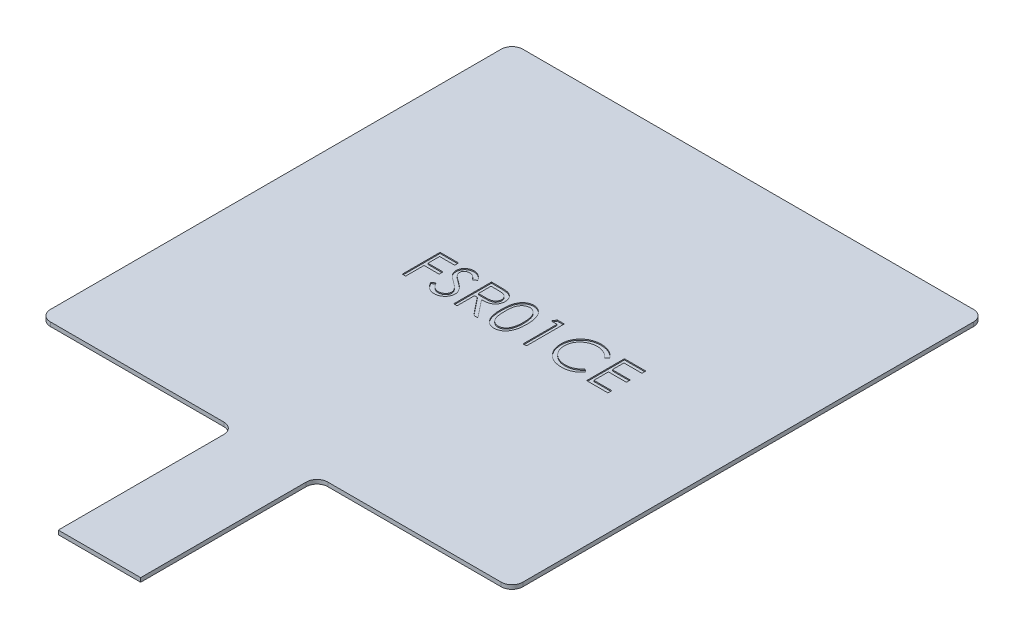
from build123d import *

# Parameters (mm, degrees)
SKETCH1_W           = 7.62
SKETCH1_H           = 16.31
SKETCH1_W_2         = 43.69
SKETCH1_H_2         = 43.69
SKETCH1_W_3         = 39.7
SKETCH1_H_3         = 39.7
BOSS_EXTRUDE1_DEPTH = 0.375
CUT_EXTRUDE1_DEPTH  = 0.1
FILLET1_R           = 1


with BuildPart() as part:
    # Sketch1 → Boss-Extrude1 (new body)
    # profile 1 of 3: a face of its own
    with BuildSketch(Plane(origin=(0, 0, 0), x_dir=(1, 0, 0), z_dir=(0, 1, 0))):
        with Locations((0, -30)):
            Rectangle(SKETCH1_W, SKETCH1_H)
    # profile 2 of 3: a face of its own
    with BuildSketch(Plane(origin=(0, 0, 0), x_dir=(1, 0, 0), z_dir=(0, 1, 0))):
        Rectangle(SKETCH1_W_2, SKETCH1_H_2)
        Rectangle(SKETCH1_W_3, SKETCH1_H_3, mode=Mode.SUBTRACT)
    # profile 3 of 3: a face of its own
    with BuildSketch(Plane(origin=(0, 0, 0), x_dir=(1, 0, 0), z_dir=(0, 1, 0))):
        Rectangle(SKETCH1_W_3, SKETCH1_H_3)
    extrude(amount=BOSS_EXTRUDE1_DEPTH)

    # Sketch2 → Cut-Extrude1 (cut)
    # profile 1 of 7: a face of its own
    with BuildSketch(Plane(origin=(0, 0.375, 0), x_dir=(1, 0, 0), z_dir=(0, 1, 0))):
        Polygon((-8.401282051, 1.75), (-6.696153846, 1.75), (-6.696153846, 1.391025641), (-8.087179487, 1.391025641), (-8.087179487, 0.314102564), (-6.696153846, 0.314102564), (-6.696153846, -0.044871795), (-8.087179487, -0.044871795), (-8.087179487, -1.75), (-8.401282051, -1.75), align=None)
    # profile 2 of 7: a face of its own
    with BuildSketch(Plane(origin=(0, 0.375, 0), x_dir=(1, 0, 0), z_dir=(0, 1, 0))):
        with BuildLine():
            Line((-6.426923077, -1.074819712), (-6.131049679, -0.897435897))
            add(Edge.make_bspline(
                [(-6.131049679, -0.897435897), (-6.103531442, -0.943500282), (-6.050807562, -1.031757866), (-5.962856202, -1.151015907), (-5.871723291, -1.252378063), (-5.776733958, -1.335254671), (-5.67846801, -1.400503558), (-5.576283956, -1.446705789), (-5.470526145, -1.475521765), (-5.398552324, -1.479021851), (-5.362620192, -1.480769231)],
                knots=[0, 0, 0, 0, 1.272034388, 2.437168799, 3.508375237, 4.49857839, 5.41946034, 6.295179144, 7.148887113, 8, 8, 8, 8], degree=3))
            add(Edge.make_bspline(
                [(-5.362620192, -1.480769231), (-5.331933332, -1.479914558), (-5.271096559, -1.478220168), (-5.181534316, -1.461939366), (-5.094552514, -1.436927237), (-5.011943876, -1.401106306), (-4.934848261, -1.35776782), (-4.867241566, -1.305421642), (-4.808795453, -1.246815437), (-4.760986338, -1.181432782), (-4.724306303, -1.111115633), (-4.696114234, -1.038939682), (-4.680469161, -0.963771114), (-4.678112407, -0.913160651), (-4.676923077, -0.887620192)],
                knots=[0, 0, 0, 0, 1.095163259, 2.171163733, 3.241058638, 4.321873601, 5.38011039, 6.391990106, 7.366004449, 8.327778327, 9.272591725, 10.192022065, 11.087607919, 12, 12, 12, 12], degree=3))
            add(Edge.make_bspline(
                [(-4.676923077, -0.887620192), (-4.678397388, -0.858479343), (-4.681394446, -0.799240253), (-4.706725926, -0.7118406), (-4.746575173, -0.62534803), (-4.783337816, -0.571846765), (-4.802423878, -0.544070513)],
                knots=[0, 0, 0, 0, 0.938893495, 1.908633276, 2.914225137, 4, 4, 4, 4], degree=3))
            add(Edge.make_bspline(
                [(-4.802423878, -0.544070513), (-4.818094492, -0.524023689), (-4.850992987, -0.481937891), (-4.907550499, -0.419292655), (-4.973916614, -0.354674236), (-5.047820168, -0.285615179), (-5.131953257, -0.215327383), (-5.223680772, -0.140459105), (-5.325344631, -0.063857528), (-5.396644127, -0.012484962), (-5.433433494, 0.014022436)],
                knots=[0, 0, 0, 0, 0.722233717, 1.516239348, 2.393582979, 3.351407094, 4.387010283, 5.505090956, 6.712668013, 8, 8, 8, 8], degree=3))
            add(Edge.make_bspline(
                [(-5.433433494, 0.014022436), (-5.47025749, 0.040251024), (-5.540662166, 0.090398086), (-5.639120749, 0.16482237), (-5.727165212, 0.232866239), (-5.804404228, 0.295170251), (-5.870803825, 0.351742856), (-5.926887236, 0.402040795), (-5.971225793, 0.447424356), (-5.995881374, 0.476865698), (-6.006951122, 0.490084135)],
                knots=[0, 0, 0, 0, 1.452282411, 2.77665338, 3.964542531, 5.026858415, 5.96415736, 6.766646006, 7.446254459, 8, 8, 8, 8], degree=3))
            add(Edge.make_bspline(
                [(-6.006951122, 0.490084135), (-6.022423667, 0.510685171), (-6.052852504, 0.551199875), (-6.093018509, 0.614524733), (-6.127157672, 0.679347998), (-6.153920004, 0.745843863), (-6.176456223, 0.813078792), (-6.191614154, 0.881930038), (-6.201105551, 0.952088656), (-6.202077537, 0.999302157), (-6.202564103, 1.022936699)],
                knots=[0, 0, 0, 0, 1.068054152, 2.10047183, 3.106115577, 4.101338837, 5.06977816, 6.043150881, 7.020423561, 8, 8, 8, 8], degree=3))
            add(Edge.make_bspline(
                [(-6.202564103, 1.022936699), (-6.201258894, 1.059966473), (-6.198676374, 1.133234537), (-6.176835856, 1.240265367), (-6.142362963, 1.342451785), (-6.094068075, 1.438782118), (-6.031810722, 1.526748099), (-5.959764747, 1.607361586), (-5.873953261, 1.675130168), (-5.779800638, 1.734342227), (-5.676744266, 1.780688152), (-5.568753362, 1.815649132), (-5.45565629, 1.83545839), (-5.379053156, 1.838301155), (-5.340184295, 1.83974359)],
                knots=[0, 0, 0, 0, 1.005424448, 1.989358655, 2.955360095, 3.929531133, 4.905563448, 5.876582895, 6.856512386, 7.866279853, 8.892233794, 9.918561126, 10.94386622, 12, 12, 12, 12], degree=3))
            add(Edge.make_bspline(
                [(-5.340184295, 1.83974359), (-5.298940195, 1.838321038), (-5.216918843, 1.835492037), (-5.096269627, 1.810894506), (-4.980108911, 1.770193834), (-4.886665646, 1.724005176), (-4.813532885, 1.67787376), (-4.757760152, 1.635853936), (-4.701242701, 1.587478827), (-4.643524646, 1.532619581), (-4.585583987, 1.47077283), (-4.526560535, 1.402362141), (-4.466316266, 1.327805585), (-4.427560406, 1.274581085), (-4.407692308, 1.247295673)],
                knots=[0, 0, 0, 0, 1.286793592, 2.559021753, 3.825965368, 5.121522368, 5.803751409, 6.523245864, 7.299691795, 8.125521123, 9.008227632, 9.944561021, 10.946284179, 12, 12, 12, 12], degree=3))
            Line((-4.407692308, 1.247295673), (-4.691646635, 1.032051282))
            add(Edge.make_bspline(
                [(-4.691646635, 1.032051282), (-4.708792567, 1.054139972), (-4.741811624, 1.096677626), (-4.791941111, 1.156248941), (-4.839189759, 1.210665421), (-4.885740159, 1.257930549), (-4.92913379, 1.300632682), (-4.971250832, 1.337192439), (-5.011485184, 1.367968034), (-5.062202094, 1.400811594), (-5.125919813, 1.433368098), (-5.205904349, 1.460917176), (-5.289490624, 1.477472238), (-5.346420255, 1.479661126), (-5.375240385, 1.480769231)],
                knots=[0, 0, 0, 0, 1.181633172, 2.275549214, 3.290209073, 4.226197932, 5.078386478, 5.862611352, 6.581680152, 7.217281963, 8.414376989, 9.595101626, 10.782541182, 12, 12, 12, 12], degree=3))
            add(Edge.make_bspline(
                [(-5.375240385, 1.480769231), (-5.411396907, 1.479557531), (-5.481121354, 1.477220882), (-5.580111591, 1.451700896), (-5.669205516, 1.411519036), (-5.745758081, 1.355204058), (-5.809495058, 1.288483065), (-5.855600516, 1.21170421), (-5.883350681, 1.126921808), (-5.886736961, 1.067780151), (-5.888461538, 1.037660256)],
                knots=[0, 0, 0, 0, 1.14458467, 2.207223713, 3.21896685, 4.227309161, 5.202851033, 6.127160689, 7.046193047, 8, 8, 8, 8], degree=3))
            add(Edge.make_bspline(
                [(-5.888461538, 1.037660256), (-5.888068412, 1.018908778), (-5.887281516, 0.981375158), (-5.876306718, 0.925923736), (-5.862207389, 0.870612397), (-5.839864757, 0.815689814), (-5.809019454, 0.760195455), (-5.768514278, 0.703173718), (-5.717500966, 0.644122009), (-5.678423953, 0.605714635), (-5.657792468, 0.585436699)],
                knots=[0, 0, 0, 0, 0.858281714, 1.717966888, 2.583508476, 3.4729293, 4.427298488, 5.488583878, 6.674047936, 8, 8, 8, 8], degree=3))
            add(Edge.make_bspline(
                [(-5.657792468, 0.585436699), (-5.650131096, 0.578599673), (-5.631929428, 0.562356465), (-5.598653503, 0.535764184), (-5.554710704, 0.502961412), (-5.501248503, 0.462374095), (-5.437281142, 0.415292633), (-5.362801585, 0.362319021), (-5.278640053, 0.301733562), (-5.218918137, 0.259376021), (-5.187339744, 0.236979167)],
                knots=[0, 0, 0, 0, 0.420754252, 0.999615792, 1.744751191, 2.668019286, 3.750313428, 4.999500688, 6.413464383, 8, 8, 8, 8], degree=3))
            add(Edge.make_bspline(
                [(-5.187339744, 0.236979167), (-5.14935383, 0.209337807), (-5.075799374, 0.155814145), (-4.971141794, 0.075398465), (-4.876247986, -0.003249303), (-4.790784782, -0.07962691), (-4.713907874, -0.153155003), (-4.646470153, -0.224718184), (-4.587784473, -0.293803756), (-4.524605254, -0.382376332), (-4.460047435, -0.491157416), (-4.404605927, -0.624435655), (-4.36964758, -0.758231975), (-4.365076065, -0.848158812), (-4.362820513, -0.892528045)],
                knots=[0, 0, 0, 0, 1.163667725, 2.253281268, 3.268753668, 4.215851969, 5.092017293, 5.902905408, 6.650798638, 7.335211899, 8.59617414, 9.77448103, 10.901945474, 12, 12, 12, 12], degree=3))
            add(Edge.make_bspline(
                [(-4.362820513, -0.892528045), (-4.363477651, -0.92390641), (-4.364779166, -0.986053794), (-4.37974008, -1.07730887), (-4.401659745, -1.16593974), (-4.434696979, -1.250850853), (-4.475020137, -1.333595615), (-4.526186385, -1.412003516), (-4.58549407, -1.487809914), (-4.653527835, -1.558993406), (-4.727973737, -1.624339602), (-4.806657432, -1.682468663), (-4.889707705, -1.730936986), (-4.976674021, -1.770487828), (-5.067576358, -1.801421346), (-5.162384142, -1.823834215), (-5.261253653, -1.837589926), (-5.328454135, -1.839017687), (-5.362620192, -1.83974359)],
                knots=[0, 0, 0, 0, 0.983748083, 1.948392443, 2.894712957, 3.844097841, 4.80183111, 5.778335162, 6.776009319, 7.81870978, 8.863265674, 9.881300176, 10.883814829, 11.87499822, 12.874611388, 13.892143829, 14.928324115, 16, 16, 16, 16], degree=3))
            add(Edge.make_bspline(
                [(-5.362620192, -1.83974359), (-5.389055535, -1.839232408), (-5.441593295, -1.838216483), (-5.519302777, -1.829235202), (-5.595442366, -1.816528099), (-5.669056648, -1.796354029), (-5.74109406, -1.771877052), (-5.811241295, -1.741738719), (-5.879532348, -1.705621518), (-5.946349931, -1.664326493), (-6.011524106, -1.616268748), (-6.074443574, -1.560295252), (-6.137172759, -1.497949747), (-6.197860156, -1.427539184), (-6.2577333, -1.350201101), (-6.31561171, -1.265211917), (-6.372693427, -1.173034564), (-6.408508895, -1.108169478), (-6.426923077, -1.074819712)],
                knots=[0, 0, 0, 0, 0.915332311, 1.819136955, 2.706846663, 3.586547465, 4.459518054, 5.340707479, 6.227863349, 7.133153174, 8.059268498, 9.028702269, 10.047606654, 11.120612155, 12.245963614, 13.433783089, 14.680604001, 16, 16, 16, 16], degree=3))
        make_face()
    # profile 3 of 7: a face of its own
    with BuildSketch(Plane(origin=(0, 0.375, 0), x_dir=(1, 0, 0), z_dir=(0, 1, 0))):
        with BuildLine():
            Line((-3.644871795, 1.75), (-2.944451122, 1.75))
            add(Edge.make_bspline(
                [(-2.944451122, 1.75), (-2.897709993, 1.749844414), (-2.807961849, 1.749545672), (-2.679388579, 1.747879909), (-2.562561482, 1.743105553), (-2.457541642, 1.73899697), (-2.364330987, 1.731505028), (-2.282643696, 1.724344381), (-2.212855999, 1.71497072), (-2.170610148, 1.706265297), (-2.151482372, 1.702323718)],
                knots=[0, 0, 0, 0, 1.410062039, 2.707475311, 3.878576406, 4.937260626, 5.877586885, 6.699081471, 7.410979367, 8, 8, 8, 8], degree=3))
            add(Edge.make_bspline(
                [(-2.151482372, 1.702323718), (-2.125875748, 1.695996953), (-2.075208758, 1.683478389), (-2.002258692, 1.657018788), (-1.932744368, 1.626399163), (-1.866954544, 1.590435443), (-1.805218753, 1.548860663), (-1.746900442, 1.502392541), (-1.691734979, 1.451285335), (-1.641953348, 1.394250494), (-1.595014297, 1.334413984), (-1.55542567, 1.269710227), (-1.52129919, 1.2020487), (-1.494128673, 1.130741282), (-1.4722507, 1.05647951), (-1.456824461, 0.978590713), (-1.447573273, 0.897429738), (-1.446631417, 0.84207183), (-1.446153846, 0.814002404)],
                knots=[0, 0, 0, 0, 1.027469482, 2.033020251, 3.019912614, 3.986113645, 4.951240523, 5.91722682, 6.890402269, 7.87763091, 8.8651537, 9.85103654, 10.82876324, 11.815024772, 12.821070561, 13.842952187, 14.906261191, 16, 16, 16, 16], degree=3))
            add(Edge.make_bspline(
                [(-1.446153846, 0.814002404), (-1.447622844, 0.767367299), (-1.45048924, 0.676370131), (-1.477214344, 0.54430925), (-1.520990863, 0.421119935), (-1.581314152, 0.306957297), (-1.658133628, 0.204046652), (-1.750458419, 0.113656197), (-1.858340031, 0.038016284), (-1.958769347, -0.014436521), (-2.047483546, -0.048029429), (-2.120516859, -0.071665788), (-2.200183837, -0.089927753), (-2.285721171, -0.106287885), (-2.377484827, -0.11863958), (-2.475254866, -0.127686174), (-2.579101018, -0.133340223), (-2.650440087, -0.134182228), (-2.687139423, -0.134615385)],
                knots=[0, 0, 0, 0, 1.260483769, 2.459530307, 3.627416485, 4.787058657, 5.939039949, 7.08810263, 8.267026773, 9.491475466, 10.141966685, 10.831826277, 11.566392101, 12.351337768, 13.187381173, 14.07005841, 15.007169909, 16, 16, 16, 16], degree=3))
            Line((-2.687139423, -0.134615385), (-1.401282051, -1.75))
            Line((-1.401282051, -1.75), (-1.789703526, -1.75))
            Line((-1.789703526, -1.75), (-3.075560897, -0.134615385))
            Line((-3.075560897, -0.134615385), (-3.330769231, -0.134615385))
            Line((-3.330769231, -0.134615385), (-3.330769231, -1.75))
            Line((-3.330769231, -1.75), (-3.644871795, -1.75))
            Line((-3.644871795, -1.75), (-3.644871795, 1.75))
        make_face()
        with BuildLine():
            Line((-3.330769231, 1.391025641), (-3.330769231, 0.224358974))
            Line((-3.330769231, 0.224358974), (-2.68994391, 0.219451122))
            add(Edge.make_bspline(
                [(-2.68994391, 0.219451122), (-2.660023871, 0.219437885), (-2.602030314, 0.219412229), (-2.518129649, 0.223406005), (-2.440009538, 0.227949323), (-2.367968786, 0.234898669), (-2.30197521, 0.24385474), (-2.242061797, 0.255057725), (-2.188130745, 0.268109787), (-2.125232207, 0.288311413), (-2.054995675, 0.320317431), (-1.978664215, 0.36688293), (-1.913661878, 0.425452049), (-1.858744015, 0.492425505), (-1.814614584, 0.566061754), (-1.78350253, 0.645478123), (-1.763760087, 0.728669721), (-1.761431542, 0.785847829), (-1.76025641, 0.814703526)],
                knots=[0, 0, 0, 0, 1.146690395, 2.22261258, 3.21895312, 4.145990853, 4.996080663, 5.770904154, 6.481378293, 7.121626537, 8.300444488, 9.431385265, 10.535395872, 11.636531494, 12.74115979, 13.810798291, 14.895190096, 16, 16, 16, 16], degree=3))
            add(Edge.make_bspline(
                [(-1.76025641, 0.814703526), (-1.761458531, 0.842850099), (-1.763840697, 0.898626338), (-1.783289465, 0.980282248), (-1.816178847, 1.057349198), (-1.860501085, 1.129513683), (-1.914500239, 1.195019419), (-1.977818052, 1.251066572), (-2.048723247, 1.297316037), (-2.114994446, 1.326870418), (-2.174228658, 1.344990271), (-2.225658318, 1.357741435), (-2.283769796, 1.367985904), (-2.348845255, 1.376193964), (-2.420606885, 1.383248909), (-2.499417536, 1.388000687), (-2.584754317, 1.390814551), (-2.643901248, 1.39095364), (-2.674519231, 1.391025641)],
                knots=[0, 0, 0, 0, 1.101028733, 2.181837193, 3.264309656, 4.369019818, 5.486613113, 6.575447106, 7.666700264, 8.788928104, 9.402425223, 10.0903467, 10.862060571, 11.710948788, 12.657782767, 13.684531032, 14.801375019, 16, 16, 16, 16], degree=3))
            Line((-2.674519231, 1.391025641), (-3.330769231, 1.391025641))
        make_face(mode=Mode.SUBTRACT)
    # profile 4 of 7: a face of its own
    with BuildSketch(Plane(origin=(0, 0.375, 0), x_dir=(1, 0, 0), z_dir=(0, 1, 0))):
        with BuildLine():
            add(Edge.make_bspline(
                [(-0.997435897, -0.001402244), (-0.997107879, 0.054695144), (-0.996470699, 0.163665128), (-0.989382278, 0.32244977), (-0.977606936, 0.471410059), (-0.961469563, 0.610553125), (-0.941831583, 0.73991489), (-0.915616096, 0.859149647), (-0.885803294, 0.968809254), (-0.851250848, 1.069251302), (-0.812263059, 1.161829005), (-0.769828798, 1.248254207), (-0.722264004, 1.328396139), (-0.672287091, 1.403533929), (-0.617875019, 1.472437624), (-0.560576229, 1.536080287), (-0.498154352, 1.592991037), (-0.432731344, 1.644837339), (-0.36371488, 1.690286811), (-0.293072214, 1.73031955), (-0.220317108, 1.764519417), (-0.145250925, 1.791409853), (-0.068548367, 1.8136207), (0.0100587, 1.828809647), (0.090700064, 1.838366556), (0.145131498, 1.839280224), (0.172736378, 1.83974359)],
                knots=[0, 0, 0, 0, 1.646270934, 3.197905019, 4.663502075, 6.030701355, 7.308322542, 8.50163776, 9.611534131, 10.641858119, 11.616356847, 12.558055219, 13.465016945, 14.349605745, 15.204443733, 16.039544428, 16.859896111, 17.680448484, 18.487036065, 19.28249412, 20.06191084, 20.843045899, 21.620316918, 22.403196591, 23.190181807, 24, 24, 24, 24], degree=3))
            add(Edge.make_bspline(
                [(0.172736378, 1.83974359), (0.200571857, 1.839255775), (0.255927866, 1.838285664), (0.337768241, 1.828961721), (0.417717923, 1.813490598), (0.495436061, 1.791569623), (0.571561048, 1.764373947), (0.645497455, 1.73028683), (0.717704537, 1.690607962), (0.787034825, 1.643984085), (0.85424944, 1.592001809), (0.917697403, 1.53323914), (0.977384489, 1.468289421), (1.034059794, 1.397847557), (1.086115391, 1.320562472), (1.135688824, 1.237778362), (1.180060859, 1.148047497), (1.222795535, 1.05286703), (1.259682521, 0.949603371), (1.292948767, 0.83883861), (1.319827735, 0.719264423), (1.342217008, 0.591508178), (1.359561904, 0.455100695), (1.372194546, 0.310334379), (1.378867631, 0.157113989), (1.380124332, 0.05235614), (1.380769231, -0.001402244)],
                knots=[0, 0, 0, 0, 0.810914788, 1.612654377, 2.396697861, 3.181598691, 3.963628158, 4.749916497, 5.551656086, 6.361998678, 7.18212741, 8.025565596, 8.878627764, 9.750805457, 10.657531673, 11.591944965, 12.560506719, 13.57287815, 14.630710178, 15.753379473, 16.941251878, 18.199788006, 19.531962791, 20.947069417, 22.433333509, 24, 24, 24, 24], degree=3))
            add(Edge.make_bspline(
                [(1.380769231, -0.001402244), (1.380117646, -0.054926152), (1.37884806, -0.159215303), (1.372269354, -0.311746279), (1.359310722, -0.455744322), (1.343100734, -0.591554784), (1.320649771, -0.718612403), (1.293044605, -0.837356852), (1.262394282, -0.948300923), (1.224559488, -1.050535735), (1.183148778, -1.145487458), (1.138093581, -1.234154606), (1.089823755, -1.317320899), (1.03723501, -1.394320646), (0.981181597, -1.465699303), (0.920463808, -1.530196926), (0.856793223, -1.589367598), (0.789380807, -1.642019225), (0.718969256, -1.68810403), (0.647010179, -1.72931788), (0.572226796, -1.762550575), (0.496313843, -1.791085616), (0.418185477, -1.812886068), (0.337939086, -1.827959923), (0.25598285, -1.838531772), (0.200581285, -1.839338252), (0.172736378, -1.83974359)],
                knots=[0, 0, 0, 0, 1.561518951, 3.042555995, 4.452378317, 5.7783523, 7.031515105, 8.214008947, 9.334062868, 10.386615937, 11.391082383, 12.354592575, 13.286541444, 14.194233754, 15.072674879, 15.931287219, 16.775624067, 17.606195743, 18.42308326, 19.229000347, 20.022332153, 20.807536673, 21.593273796, 22.3848459, 23.188221202, 24, 24, 24, 24], degree=3))
            add(Edge.make_bspline(
                [(0.172736378, -1.83974359), (0.145132264, -1.839277234), (0.090702339, -1.838357672), (0.010049914, -1.828843941), (-0.068232529, -1.813548438), (-0.144531283, -1.792131834), (-0.219237799, -1.765916997), (-0.291334085, -1.731763314), (-0.361621769, -1.692429245), (-0.429913325, -1.647633823), (-0.494925486, -1.59631214), (-0.557024091, -1.539547851), (-0.61464911, -1.47592444), (-0.668283206, -1.406446517), (-0.719257294, -1.331753275), (-0.766146667, -1.250824902), (-0.809517522, -1.163982291), (-0.849161012, -1.07066438), (-0.884309676, -0.969509453), (-0.915357384, -0.859360274), (-0.939871541, -0.739244638), (-0.960854497, -0.610127271), (-0.97777888, -0.471453341), (-0.989333205, -0.323147562), (-0.99647452, -0.165302353), (-0.99710959, -0.057032579), (-0.997435897, -0.001402244)],
                knots=[0, 0, 0, 0, 0.810891512, 1.598919785, 2.382837074, 3.152667961, 3.926044502, 4.706494248, 5.493654104, 6.291793342, 7.103789334, 7.925228297, 8.761435821, 9.622817696, 10.50288917, 11.416980706, 12.369136599, 13.353924996, 14.394355917, 15.514179734, 16.714354668, 17.994756427, 19.357759367, 20.818452758, 22.365282078, 24, 24, 24, 24], degree=3))
        make_face()
        with BuildLine():
            add(Edge.make_bspline(
                [(-0.683333333, 0), (-0.683213886, -0.046748699), (-0.682982063, -0.137478744), (-0.676925862, -0.269322005), (-0.66867563, -0.392292333), (-0.658034333, -0.50654587), (-0.642231385, -0.611695882), (-0.624524597, -0.708465565), (-0.602976507, -0.796342803), (-0.577481489, -0.875930613), (-0.548442392, -0.948579682), (-0.516736529, -1.016180897), (-0.482675806, -1.079532833), (-0.444556655, -1.138066442), (-0.403041592, -1.191972606), (-0.359068333, -1.242205438), (-0.310995749, -1.287002419), (-0.244492006, -1.340729274), (-0.156695532, -1.396248408), (-0.046075077, -1.444594498), (0.067593374, -1.474976954), (0.144744625, -1.47884071), (0.183253205, -1.480769231)],
                knots=[0, 0, 0, 0, 1.459021318, 2.831673884, 4.118529203, 5.306027144, 6.411944654, 7.436330062, 8.375795394, 9.233974572, 10.042671642, 10.816086306, 11.563610507, 12.285937304, 12.993564865, 13.685989202, 14.367179055, 15.041617293, 16.353048772, 17.594441528, 18.799311195, 20, 20, 20, 20], degree=3))
            add(Edge.make_bspline(
                [(0.183253205, -1.480769231), (0.222010877, -1.47917145), (0.2994462, -1.475979187), (0.412579995, -1.44518045), (0.522410265, -1.39871091), (0.608482205, -1.343763405), (0.673964749, -1.291435075), (0.720881739, -1.246820427), (0.763943788, -1.19686456), (0.804785862, -1.142965264), (0.842244938, -1.08409278), (0.876308076, -1.020530204), (0.907391423, -0.952101027), (0.925100469, -0.904331287), (0.934154647, -0.879907853)],
                knots=[0, 0, 0, 0, 1.353760809, 2.704726607, 4.075137775, 5.516104923, 6.260822281, 7.007110065, 7.778089737, 8.566572457, 9.372053459, 10.217411131, 11.088608312, 12, 12, 12, 12], degree=3))
            add(Edge.make_bspline(
                [(0.934154647, -0.879907853), (0.944706415, -0.848678113), (0.966131029, -0.785268349), (0.993742803, -0.686904697), (1.015488203, -0.583701933), (1.035051568, -0.476276816), (1.048404624, -0.363837115), (1.059152437, -0.246730731), (1.065483124, -0.124869369), (1.066267875, -0.042074378), (1.066666667, 0)],
                knots=[0, 0, 0, 0, 0.884706709, 1.796334032, 2.740027952, 3.714592787, 4.726048262, 5.777819803, 6.87074269, 8, 8, 8, 8], degree=3))
            add(Edge.make_bspline(
                [(1.066666667, 0), (1.066116477, 0.042067573), (1.06504019, 0.124360737), (1.060926202, 0.244878918), (1.050302627, 0.359346679), (1.038503509, 0.468257152), (1.021106288, 0.571007454), (1.002348481, 0.668457759), (0.977147268, 0.759400784), (0.950227493, 0.845260366), (0.919417098, 0.925061021), (0.885501364, 0.999174807), (0.849279605, 1.067959532), (0.809937364, 1.131226473), (0.767941681, 1.189259016), (0.722184132, 1.240893611), (0.674479759, 1.287730579), (0.607662573, 1.341193148), (0.520188284, 1.395704843), (0.411342636, 1.445870603), (0.298071992, 1.474678896), (0.221498538, 1.478740583), (0.183253205, 1.480769231)],
                knots=[0, 0, 0, 0, 1.31362396, 2.569729283, 3.763502607, 4.902122613, 5.988968491, 7.01645872, 7.998833611, 8.933434873, 9.825090667, 10.667526885, 11.477055099, 12.250526234, 12.991942729, 13.710640831, 14.402115721, 15.076753259, 16.378508321, 17.609869233, 18.806226677, 20, 20, 20, 20], degree=3))
            add(Edge.make_bspline(
                [(0.183253205, 1.480769231), (0.144542613, 1.478737784), (0.067050907, 1.47467119), (-0.047397047, 1.445977936), (-0.157101399, 1.39596497), (-0.244344374, 1.341012598), (-0.31120816, 1.288674287), (-0.358290853, 1.243287833), (-0.402437026, 1.193641578), (-0.443104726, 1.139239663), (-0.481194009, 1.080774296), (-0.516175022, 1.017785531), (-0.547692351, 0.949954167), (-0.576776887, 0.877337732), (-0.602349676, 0.797756787), (-0.623443639, 0.709987794), (-0.642930692, 0.613525902), (-0.656725961, 0.507806394), (-0.668989717, 0.39352424), (-0.676871064, 0.270246922), (-0.683002322, 0.138182542), (-0.683220786, 0.046983383), (-0.683333333, 0)],
                knots=[0, 0, 0, 0, 1.207732386, 2.417664972, 3.655092373, 4.956220595, 5.625982001, 6.301752483, 6.994047911, 7.697131622, 8.419323945, 9.170223765, 9.943494443, 10.752040957, 11.610060368, 12.549350801, 13.567764191, 14.679664412, 15.874934091, 17.154273443, 18.533957287, 20, 20, 20, 20], degree=3))
        make_face(mode=Mode.SUBTRACT)
    # profile 5 of 7: a face of its own
    with BuildSketch(Plane(origin=(0, 0.375, 0), x_dir=(1, 0, 0), z_dir=(0, 1, 0))):
        Polygon((2.438762019, 1.75), (3.085897436, 1.75), (3.085897436, -1.75), (2.771794872, -1.75), (2.771794872, 1.391025641), (2.233333333, 1.391025641), align=None)
    # profile 6 of 7: a face of its own
    with BuildSketch(Plane(origin=(0, 0.375, 0), x_dir=(1, 0, 0), z_dir=(0, 1, 0))):
        with BuildLine():
            Line((7.932051282, 1.107772436), (7.657211538, 0.897435897))
            add(Edge.make_bspline(
                [(7.657211538, 0.897435897), (7.63760565, 0.920801867), (7.598658203, 0.967218783), (7.535999001, 1.032398327), (7.470697358, 1.093463589), (7.402778237, 1.150705469), (7.331019117, 1.202122234), (7.257158318, 1.250393337), (7.179960273, 1.293661075), (7.073208539, 1.346124061), (6.93356069, 1.400870216), (6.757765851, 1.446773448), (6.574254753, 1.475994623), (6.449057153, 1.479159465), (6.385376603, 1.480769231)],
                knots=[0, 0, 0, 0, 0.757959112, 1.505699292, 2.245454638, 2.979532153, 3.711538275, 4.438200793, 5.171680507, 5.909471876, 7.393775596, 8.890124382, 10.418191784, 12, 12, 12, 12], degree=3))
            add(Edge.make_bspline(
                [(6.385376603, 1.480769231), (6.350293303, 1.480365268), (6.280452311, 1.479561092), (6.176803837, 1.468951967), (6.075090786, 1.454040757), (5.97537932, 1.431915434), (5.877796361, 1.403942815), (5.781703959, 1.370517401), (5.688493359, 1.329162561), (5.596875121, 1.283454301), (5.50909591, 1.231826856), (5.426040862, 1.175513504), (5.348012894, 1.115144408), (5.274950282, 1.050493302), (5.206778334, 0.981851341), (5.143991023, 0.908487), (5.086805613, 0.830634826), (5.034088588, 0.749321419), (4.986875855, 0.664783627), (4.947345975, 0.576708556), (4.912340853, 0.486604453), (4.88464161, 0.393453293), (4.862717093, 0.297910527), (4.84758943, 0.199719739), (4.837100959, 0.099086059), (4.836300782, 0.030876747), (4.835897436, -0.003505609)],
                knots=[0, 0, 0, 0, 1.054917814, 2.100044995, 3.131103042, 4.146048494, 5.169673617, 6.183595914, 7.203665975, 8.234915748, 9.262203917, 10.264457458, 11.251630812, 12.227803204, 13.197192746, 14.159520551, 15.12972552, 16.100847026, 17.073214652, 18.039054194, 19.002613845, 19.979014051, 20.95965708, 21.949030935, 22.966165397, 24, 24, 24, 24], degree=3))
            add(Edge.make_bspline(
                [(4.835897436, -0.003505609), (4.837159255, -0.055236929), (4.839636669, -0.156804514), (4.861685003, -0.305575124), (4.895190095, -0.448095798), (4.945405672, -0.58347564), (5.007324722, -0.713383998), (5.085565334, -0.835622852), (5.176181871, -0.952039416), (5.28045629, -1.059882364), (5.394862106, -1.158396089), (5.517610018, -1.245146671), (5.648394306, -1.317461553), (5.785770936, -1.3776375), (5.93079705, -1.423894228), (6.083211852, -1.456458351), (6.242683848, -1.477700532), (6.351653247, -1.47973422), (6.407111378, -1.480769231)],
                knots=[0, 0, 0, 0, 1.029171465, 2.020641659, 2.987623507, 3.938342917, 4.889210282, 5.84687017, 6.821220943, 7.821438502, 8.827599549, 9.822697543, 10.807740252, 11.797342354, 12.80366471, 13.83203677, 14.896651826, 16, 16, 16, 16], degree=3))
            add(Edge.make_bspline(
                [(6.407111378, -1.480769231), (6.468214067, -1.479080451), (6.588478776, -1.475756528), (6.764846802, -1.447597279), (6.933682568, -1.401939362), (7.094995155, -1.338041439), (7.248329801, -1.254976151), (7.393926461, -1.154278274), (7.531908032, -1.034989941), (7.614879314, -0.943906813), (7.657211538, -0.897435897)],
                knots=[0, 0, 0, 0, 1.028121516, 2.023589091, 2.998037872, 3.967518031, 4.937445131, 5.927275754, 6.942489185, 8, 8, 8, 8], degree=3))
            Line((7.657211538, -0.897435897), (7.932051282, -1.105669071))
            add(Edge.make_bspline(
                [(7.932051282, -1.105669071), (7.909933172, -1.134207522), (7.865802897, -1.191147729), (7.79434488, -1.271419438), (7.719067583, -1.346923474), (7.639411873, -1.417051095), (7.556294081, -1.483205561), (7.468221769, -1.543507392), (7.376352736, -1.598798276), (7.280998257, -1.649425201), (7.182259644, -1.694342448), (7.080255209, -1.732796216), (6.975424634, -1.765921105), (6.867763126, -1.793173042), (6.757047369, -1.814444126), (6.643676895, -1.828663801), (6.527407019, -1.838405715), (6.448965598, -1.839293631), (6.409214744, -1.83974359)],
                knots=[0, 0, 0, 0, 0.986787822, 1.968848986, 2.935600012, 3.899624008, 4.868462664, 5.837806735, 6.815139263, 7.798259679, 8.787526145, 9.778297419, 10.776456485, 11.791383307, 12.812564526, 13.85620153, 14.913611965, 16, 16, 16, 16], degree=3))
            add(Edge.make_bspline(
                [(6.409214744, -1.83974359), (6.371571077, -1.839481597), (6.297135386, -1.838963539), (6.187236635, -1.830571372), (6.080247054, -1.819121635), (5.976472428, -1.801881504), (5.875346453, -1.781537164), (5.777785869, -1.754265907), (5.682830658, -1.723716741), (5.590862318, -1.687811754), (5.501802618, -1.647295571), (5.415938806, -1.601504013), (5.333310374, -1.550822148), (5.253104953, -1.496367137), (5.176507369, -1.436389836), (5.102853844, -1.371723201), (5.031731368, -1.30258519), (4.987728683, -1.252730337), (4.965604968, -1.227664263)],
                knots=[0, 0, 0, 0, 1.114604814, 2.203992996, 3.262667896, 4.300477797, 5.318619304, 6.316056647, 7.298880507, 8.271930387, 9.238335007, 10.195173496, 11.151986948, 12.108099108, 13.064862484, 14.031167946, 15.010108607, 16, 16, 16, 16], degree=3))
            add(Edge.make_bspline(
                [(4.965604968, -1.227664263), (4.930169324, -1.184123074), (4.859725848, -1.097566363), (4.769600164, -0.957280382), (4.692452609, -0.810812173), (4.630076688, -0.657392245), (4.581313955, -0.497364857), (4.54753276, -0.330649343), (4.525581155, -0.157401401), (4.523070867, -0.039564612), (4.521794872, 0.020332532)],
                knots=[0, 0, 0, 0, 0.994628077, 1.977248131, 2.950237994, 3.925870899, 4.908910175, 5.911660606, 6.938484602, 8, 8, 8, 8], degree=3))
            add(Edge.make_bspline(
                [(4.521794872, 0.020332532), (4.523350065, 0.083287986), (4.526409812, 0.20714891), (4.552405607, 0.388922863), (4.594224403, 0.563074262), (4.653621292, 0.729278007), (4.728926643, 0.888408287), (4.821953257, 1.039249492), (4.931620399, 1.182766292), (5.057067967, 1.316781043), (5.194635302, 1.439320396), (5.341954116, 1.547126599), (5.498736063, 1.636844115), (5.663253915, 1.711840278), (5.836739596, 1.769484741), (6.018822965, 1.809837928), (6.20916188, 1.834955044), (6.339024306, 1.838130252), (6.405008013, 1.83974359)],
                knots=[0, 0, 0, 0, 1.032925535, 2.032216505, 3.007276963, 3.968222605, 4.92396291, 5.891752235, 6.871517503, 7.883894988, 8.900124299, 9.891468569, 10.874487609, 11.85992873, 12.854644235, 13.869047385, 14.917252991, 16, 16, 16, 16], degree=3))
            add(Edge.make_bspline(
                [(6.405008013, 1.83974359), (6.445222485, 1.839261452), (6.524822982, 1.838307108), (6.642575634, 1.829000965), (6.757217961, 1.813487359), (6.868828943, 1.792371289), (6.97795156, 1.766163968), (7.083751801, 1.73202367), (7.186850487, 1.692987138), (7.286597396, 1.648028672), (7.382513946, 1.597561931), (7.474570264, 1.542146307), (7.562035123, 1.481850502), (7.645523971, 1.417187326), (7.723640182, 1.346788767), (7.798601661, 1.272591171), (7.867862739, 1.192457347), (7.910615934, 1.136052413), (7.932051282, 1.107772436)],
                knots=[0, 0, 0, 0, 1.096760587, 2.17092713, 3.219439832, 4.250915756, 5.268269357, 6.278326846, 7.281116186, 8.274029601, 9.260640565, 10.235837813, 11.203064059, 12.156899882, 13.114053108, 14.069676657, 15.032185724, 16, 16, 16, 16], degree=3))
        make_face()
    # profile 7 of 7: a face of its own
    with BuildSketch(Plane(origin=(0, 0.375, 0), x_dir=(1, 0, 0), z_dir=(0, 1, 0))):
        Polygon((8.65, 1.75), (10.624358974, 1.75), (10.624358974, 1.391025641), (8.964102564, 1.391025641), (8.964102564, 0.314102564), (10.624358974, 0.314102564), (10.624358974, -0.044871795), (8.964102564, -0.044871795), (8.964102564, -1.391025641), (10.624358974, -1.391025641), (10.624358974, -1.75), (8.65, -1.75), align=None)
    extrude(amount=-CUT_EXTRUDE1_DEPTH, mode=Mode.SUBTRACT)

    # Fillet1
    fillet1_edges = [part.edges().sort_by_distance(p)[0] for p in [
        (-3.81, 0.1875, 21.845),
        (-21.845, 0.1875, 21.845),
        (-21.845, 0.1875, -21.845),
        (21.845, 0.1875, -21.845),
        (21.845, 0.1875, 21.845),
        (3.81, 0.1875, 21.845),
    ]]
    fillet(fillet1_edges, radius=FILLET1_R)


solid = part.part
